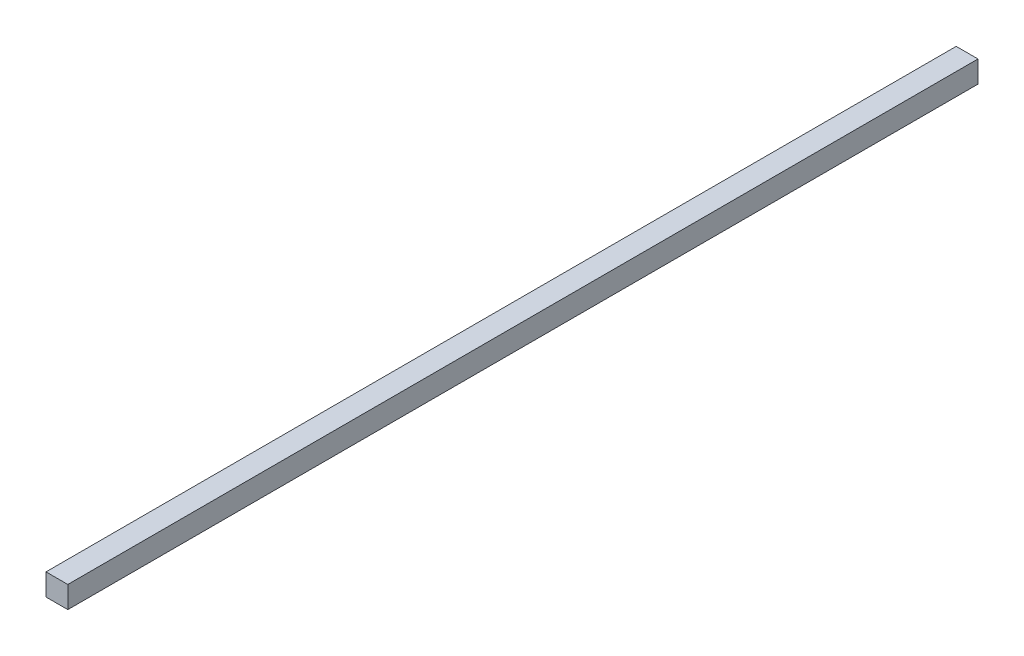
from build123d import *

# Parameters (mm, degrees)
SKETCH3_W           = 6.35
SKETCH3_H           = 6.35
BOSS_EXTRUDE1_DEPTH = 132.5


with BuildPart() as part:
    # Sketch3 → Boss-Extrude1 (new, symmetric)
    with BuildSketch(Plane.XY):
        Rectangle(SKETCH3_W, SKETCH3_H)
    extrude(amount=BOSS_EXTRUDE1_DEPTH, both=True)


solid = part.part
